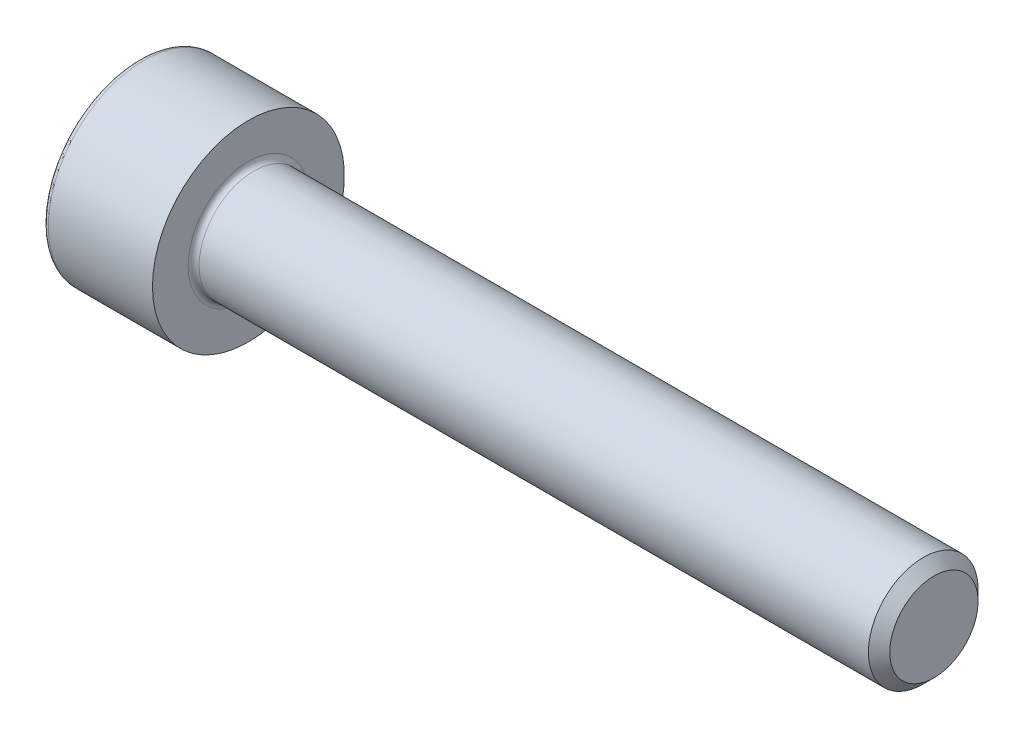
from build123d import *

# Parameters (mm, degrees)
FILLET1_R   = 0.2
FILLET2_R   = 0.2
HEX_2_DEPTH = 2


with BuildPart() as part:
    # BodySke → BaseBody (revolve)
    with BuildSketch(Plane.XY, mode=Mode.PRIVATE) as basebody_sk:
        Polygon((0, 0), (0, 3.5), (4, 3.5), (4, 2), (28.61, 2), (29, 1.61), (29, 0), align=None)
    revolve(basebody_sk.sketch.rotate(Axis((0, 0, 0), (1, 0, 0)), 90), axis=Axis((0, 0, 0), (1, 0, 0)))

    # Fillet1
    fillet1_edges = [part.edges().sort_by_distance(p)[0] for p in [
        (4, 0, -2),
    ]]
    fillet(fillet1_edges, radius=FILLET1_R)

    # Fillet2
    fillet2_edges = [part.edges().sort_by_distance(p)[0] for p in [
        (0, 0, -3.5),
    ]]
    fillet(fillet2_edges, radius=FILLET2_R)

    # HexSke → Hex 2 (cut)
    with BuildSketch(Plane(origin=(0, 0, 0), x_dir=(0, 0, -1), z_dir=(1, 0, 0))):
        Polygon((0, 1.732050808), (-1.5, 0.866025404), (-1.5, -0.866025404), (0, -1.732050808), (1.5, -0.866025404), (1.5, 0.866025404), align=None)
    extrude(amount=HEX_2_DEPTH, mode=Mode.SUBTRACT)

    # Hex-PreBroachSke → Hex-PreBroach (revolve, cut)
    with BuildSketch(Plane.XY, mode=Mode.PRIVATE) as hex_prebroach_sk:
        Polygon((0, 0), (0, 1.5), (2, 1.5), (2.866025404, 0), align=None)
    revolve(hex_prebroach_sk.sketch.rotate(Axis((0, 0, 0), (1, 0, 0)), 270), axis=Axis((0, 0, 0), (1, 0, 0)), mode=Mode.SUBTRACT)


solid = part.part
